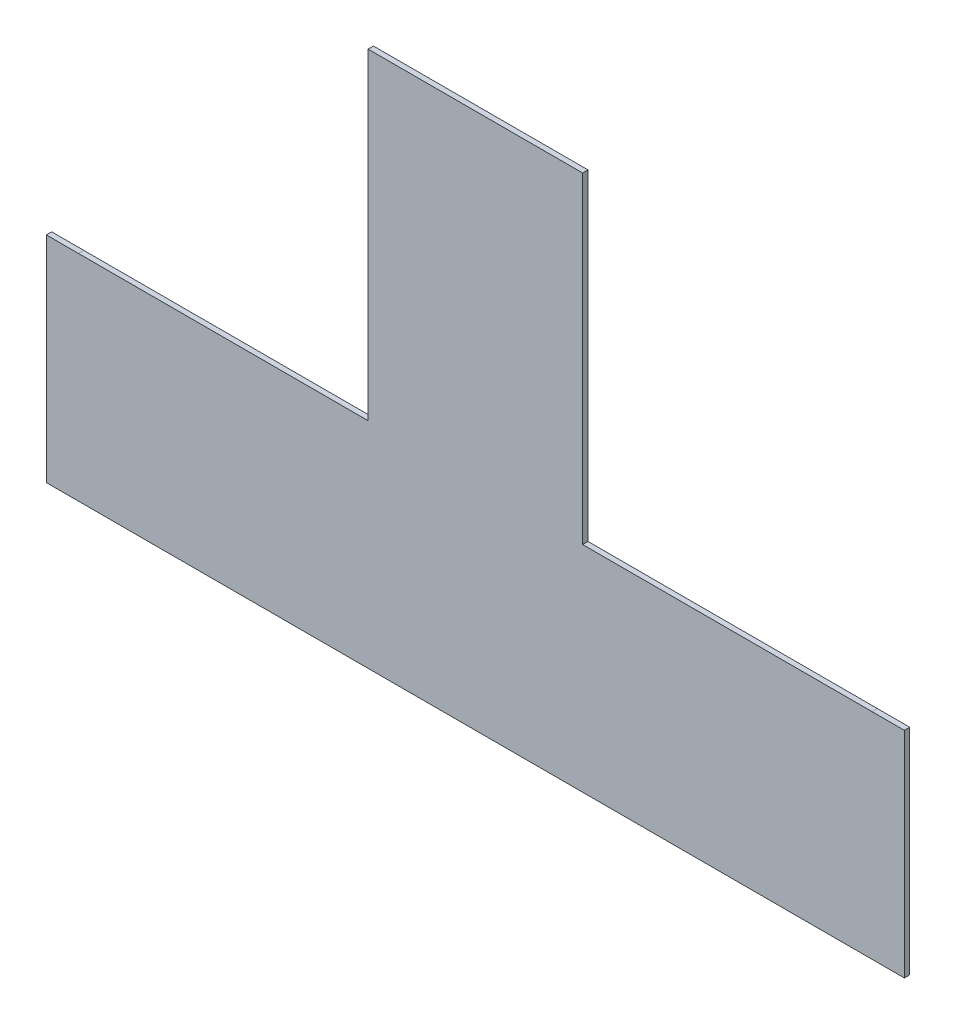
from build123d import *

# Parameters (mm, degrees)
BOSS_EXTRUDE1_DEPTH = 1


with BuildPart() as part:
    # Sketch1 → Boss-Extrude1 (new body)
    with BuildSketch(Plane.XY):
        Polygon((80, 0), (80, 100), (60, 100), (60, 40), (0, 40), (0, 0), align=None)
        Polygon((100, 100), (80, 100), (80, 0), (160, 0), (160, 40), (100, 40), align=None)
    extrude(amount=BOSS_EXTRUDE1_DEPTH)


solid = part.part
